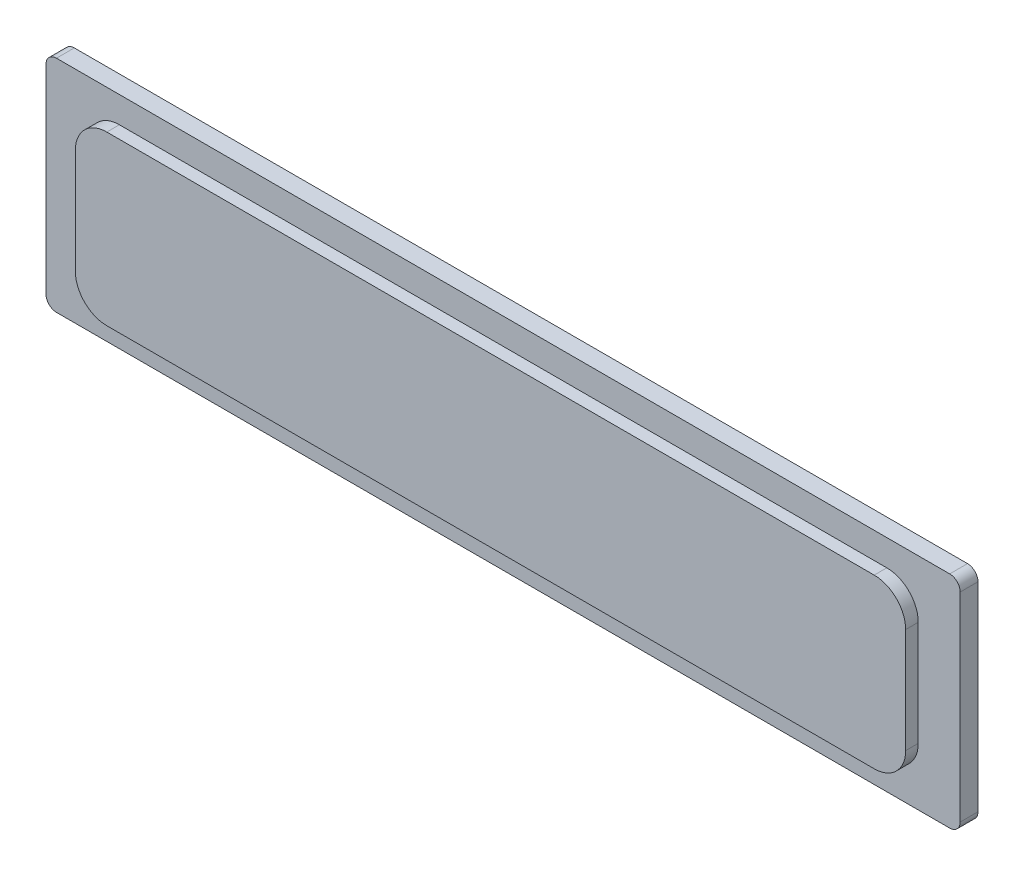
from build123d import *

# Parameters (mm, degrees)
SKETCH_1_W      = 87.2
SKETCH_1_H      = 21
EXTRUDE_1_DEPTH = 1.7
SKETCH_2_W      = 79.2
SKETCH_2_H      = 16
EXTRUDE_2_DEPTH = 1.2
FILLET_1_R      = 3
FILLET_2_R      = 1


with BuildPart() as part:
    # Эскиз1 → Бобышка-Вытянуть1 (new body)
    with BuildSketch(Plane.XY):
        Rectangle(SKETCH_1_W, SKETCH_1_H)
    extrude(amount=EXTRUDE_1_DEPTH)

    # Эскиз2 → Бобышка-Вытянуть2 (add)
    with BuildSketch(Plane.XY.offset(1.7)):
        Rectangle(SKETCH_2_W, SKETCH_2_H)
    extrude(amount=EXTRUDE_2_DEPTH)

    # Скругление1
    fillet_1_edges = [part.edges().sort_by_distance(p)[0] for p in [
        (39.6, -8, 2.3),
        (39.6, 8, 2.3),
        (-39.6, 8, 2.3),
        (-39.6, -8, 2.3),
    ]]
    fillet(fillet_1_edges, radius=FILLET_1_R)

    # Скругление2
    fillet_2_edges = [part.edges().sort_by_distance(p)[0] for p in [
        (43.6, -10.5, 0.85),
        (-43.6, -10.5, 0.85),
        (-43.6, 10.5, 0.85),
        (43.6, 10.5, 0.85),
    ]]
    fillet(fillet_2_edges, radius=FILLET_2_R)


solid = part.part
